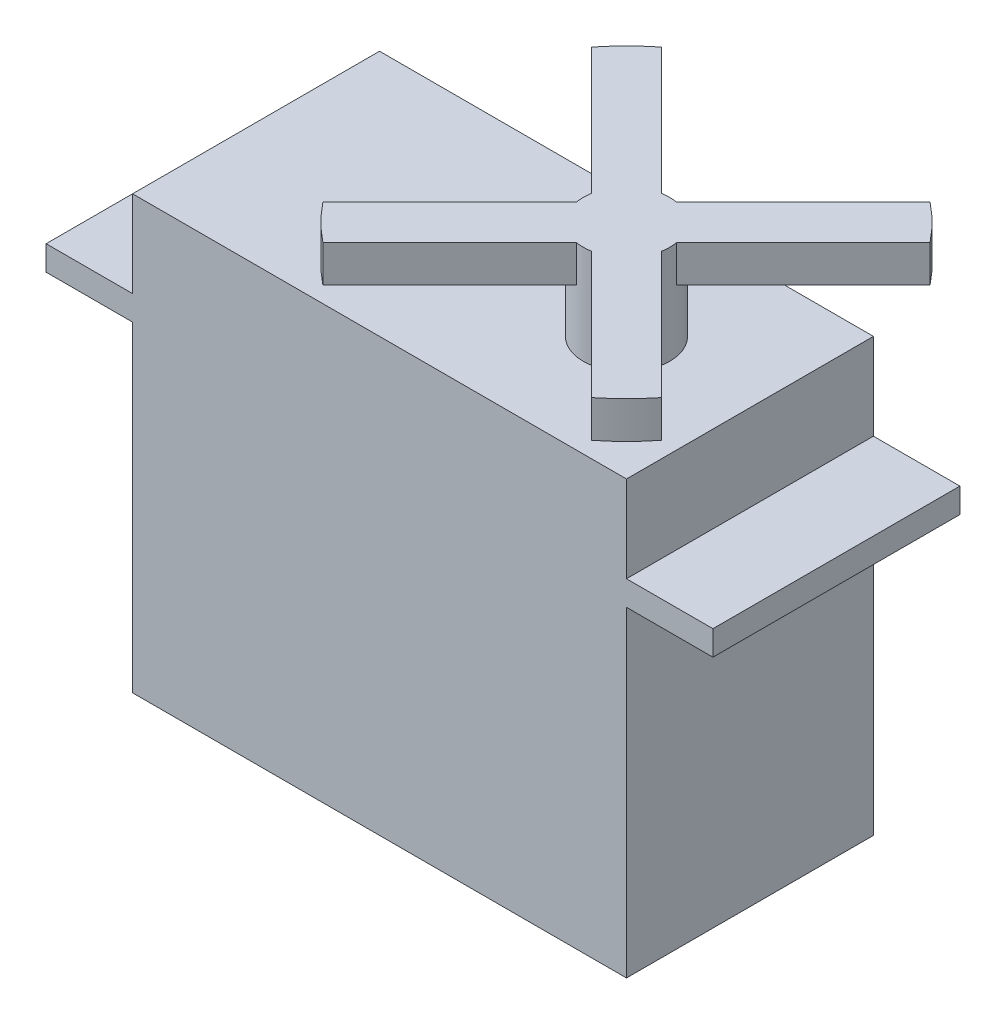
from build123d import *
from build123d.topology import SkipClean

# Parameters (mm, degrees)
EXTRUSION1_DEPTH = 20
ESQUISSE2_R      = 3.5
EXTRUSION2_DEPTH = 8
EXTRUSION3_START = -3
EXTRUSION3_DEPTH = 3


with BuildPart() as part:
    # Esquisse1 → Extrusion1 (new body)
    with BuildSketch(Plane.XY):
        Polygon((-21.808080808, -11.643556434), (-21.808080808, 14.356443566), (-28.808080808, 14.356443566), (-28.808080808, 16.356443566), (-21.808080808, 16.356443566), (-21.808080808, 23.356443566), (18.191919192, 23.356443566), (18.191919192, 16.356443566), (25.191919192, 16.356443566), (25.191919192, 14.356443566), (18.191919192, 14.356443566), (18.191919192, -11.643556434), align=None)
    extrude(amount=EXTRUSION1_DEPTH)

    # Esquisse2 → Extrusion2 (add)
    with BuildSketch(Plane(origin=(0, 23.356443566, 0), x_dir=(1, 0, 0), z_dir=(0, 1, 0))):
        with Locations((8.191919192, -10)):
            Circle(ESQUISSE2_R)
    extrude(amount=EXTRUSION2_DEPTH)

    # Esquisse3 → Extrusion3 (add)
    with SkipClean():  # the faces are left unmerged after this step: merging them gives an invalid solid
        with BuildSketch(Plane(origin=(0, 31.356443566, 0), x_dir=(1, 0, 0), z_dir=(0, 1, 0)).offset(EXTRUSION3_START)):
            with BuildLine():
                Line((4.746696028, -9.383203961), (-5.515585224, 0.879077291))
                ThreePointArc((-5.515585224, 0.879077291), (-4.182449479, 2.374368671), (-2.687158099, 3.707504416))
                Line((-2.687158099, 3.707504416), (7.575123153, -6.554776836))
                ThreePointArc((7.575123153, -6.554776836), (8.191919192, -6.5), (8.808715231, -6.554776836))
                Line((8.808715231, -6.554776836), (19.069778625, 3.706286557))
                ThreePointArc((19.069778625, 3.706286557), (20.565077985, 2.373158793), (21.898205749, 0.877859433))
                Line((21.898205749, 0.877859433), (11.637142355, -9.383203961))
                ThreePointArc((11.637142355, -9.383203961), (11.691919192, -10), (11.637142355, -10.616796039))
                Line((11.637142355, -10.616796039), (21.899423607, -20.879077291))
                ThreePointArc((21.899423607, -20.879077291), (20.566287863, -22.374368671), (19.070996483, -23.707504416))
                Line((19.070996483, -23.707504416), (8.808715231, -13.445223164))
                ThreePointArc((8.808715231, -13.445223164), (8.191919192, -13.5), (7.575123153, -13.445223164))
                Line((7.575123153, -13.445223164), (-2.687158099, -23.707504416))
                ThreePointArc((-2.687158099, -23.707504416), (-4.182449479, -22.374368671), (-5.515585224, -20.879077291))
                Line((-5.515585224, -20.879077291), (4.746696028, -10.616796039))
                ThreePointArc((4.746696028, -10.616796039), (4.691919192, -10), (4.746696028, -9.383203961))
            make_face()
        extrude(amount=EXTRUSION3_DEPTH)


solid = part.part
